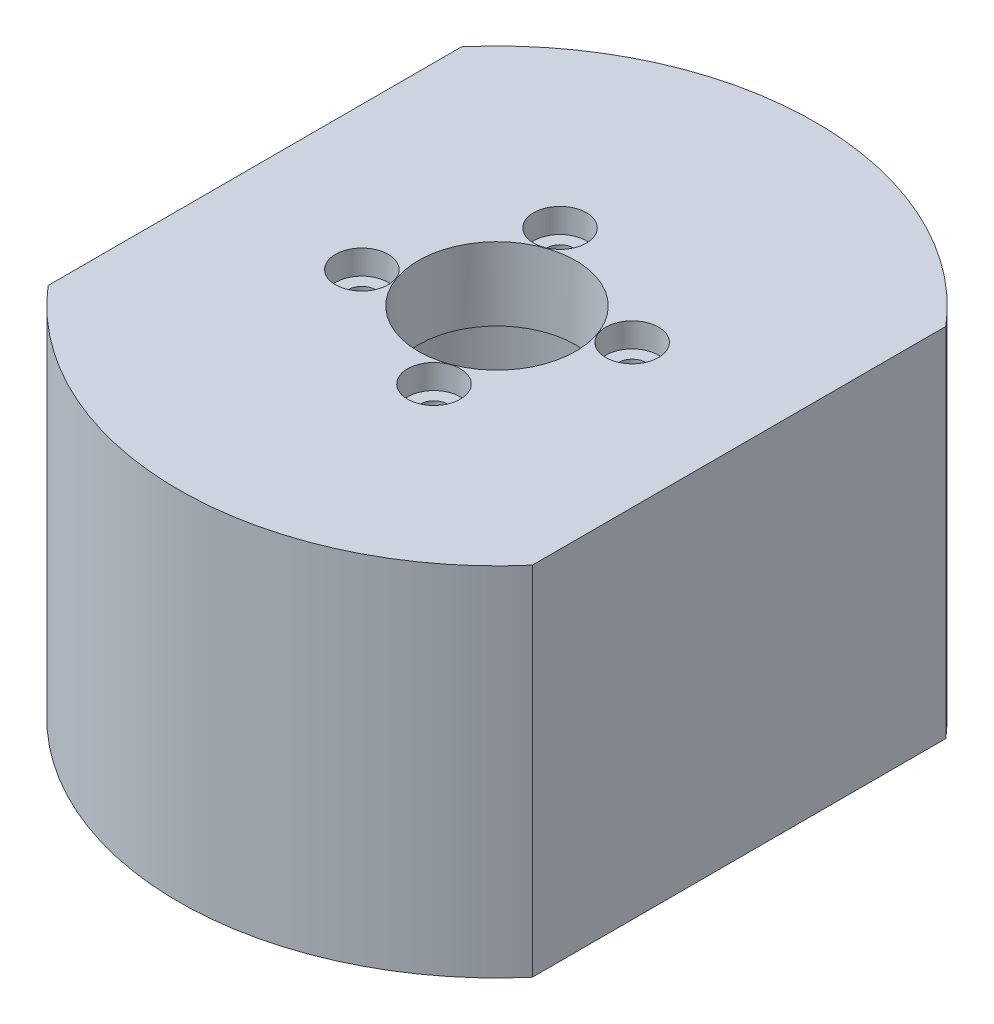
from build123d import *

# Parameters (mm, degrees)
BOSS_EXTRUDE1_DEPTH            = 44
CBORE_FOR_M3_SHCS1_D           = 3.4
CBORE_FOR_M3_SHCS1_CBORE_D     = 6.5
CBORE_FOR_M3_SHCS1_CBORE_DEPTH = 3
CIRPATTERN1_COUNT              = 4
SKETCH4_R                      = 16.2
CUT_EXTRUDE1_DEPTH             = 35
SKETCH5_R                      = 9.7
CUT_EXTRUDE2_DEPTH             = 66.498740446
BOSS_EXTRUDE2_DEPTH            = 44


with BuildPart() as part:
    # Sketch1 → Boss-Extrude1 (new body)
    with BuildSketch(Plane(origin=(0, 0, 0), x_dir=(1, 0, 0), z_dir=(0, 1, 0))):
        with BuildLine():
            Line((-29.85, 23.917357714), (-29.85, -23.917357714))
            ThreePointArc((-29.85, -23.917357714), (0, -38.25), (29.85, -23.917357714))
            Line((29.85, -23.917357714), (29.85, 23.917357714))
            ThreePointArc((29.85, 23.917357714), (0, 38.25), (-29.85, 23.917357714))
        make_face()
    extrude(amount=BOSS_EXTRUDE1_DEPTH)

    # CBORE for M3 SHCS1 (through all)
    with Locations(Plane(origin=(0, 44, 0), x_dir=(1, 0, 0), z_dir=(0, 1, 0))):
        with Locations((-4.446261863, 12.21600407)):
            cbore_for_m3_shcs1 = CounterBoreHole(CBORE_FOR_M3_SHCS1_D / 2, CBORE_FOR_M3_SHCS1_CBORE_D / 2, CBORE_FOR_M3_SHCS1_CBORE_DEPTH)

    # CirPattern1: CBORE for M3 SHCS1 ×4 about axis
    cirpattern1_axis = Axis((0, 0, 0), (0, 1, 0))
    for i in range(1, CIRPATTERN1_COUNT):
        add(cbore_for_m3_shcs1.rotate(cirpattern1_axis, i * 360 / CIRPATTERN1_COUNT), mode=Mode.SUBTRACT)

    # Sketch4 → Cut-Extrude1 (cut)
    with BuildSketch(Plane.XZ):
        with Locations(Location((0, 0, 0), (0, 0, 270))):
            Circle(SKETCH4_R)
    extrude(amount=-CUT_EXTRUDE1_DEPTH, mode=Mode.SUBTRACT)

    # Sketch5 → Cut-Extrude2 (cut, through all)
    with BuildSketch(Plane(origin=(0, 44, 0), x_dir=(1, 0, 0), z_dir=(0, 1, 0))):
        with Locations(Location((0, 0, 0), (0, 0, 270))):
            Circle(SKETCH5_R)
    extrude(amount=-CUT_EXTRUDE2_DEPTH, mode=Mode.SUBTRACT)

    # Sketch7 → Boss-Extrude2 (add)
    with BuildSketch(Plane.XZ):
        with BuildLine():
            Line((-29.85, 23.917357714), (-29.85, 25.486074629))
            ThreePointArc((-29.85, 25.486074629), (0, 39.25), (29.85, 25.486074629))
            Line((29.85, 25.486074629), (29.85, 23.917357714))
            ThreePointArc((29.85, 23.917357714), (0, 38.25), (-29.85, 23.917357714))
        make_face()
        with BuildLine():
            Line((29.85, -23.917357714), (29.85, -25.486074629))
            ThreePointArc((29.85, -25.486074629), (0, -39.25), (-29.85, -25.486074629))
            Line((-29.85, -25.486074629), (-29.85, -23.917357714))
            ThreePointArc((-29.85, -23.917357714), (0, -38.25), (29.85, -23.917357714))
        make_face()
    extrude(amount=-BOSS_EXTRUDE2_DEPTH)


solid = part.part
